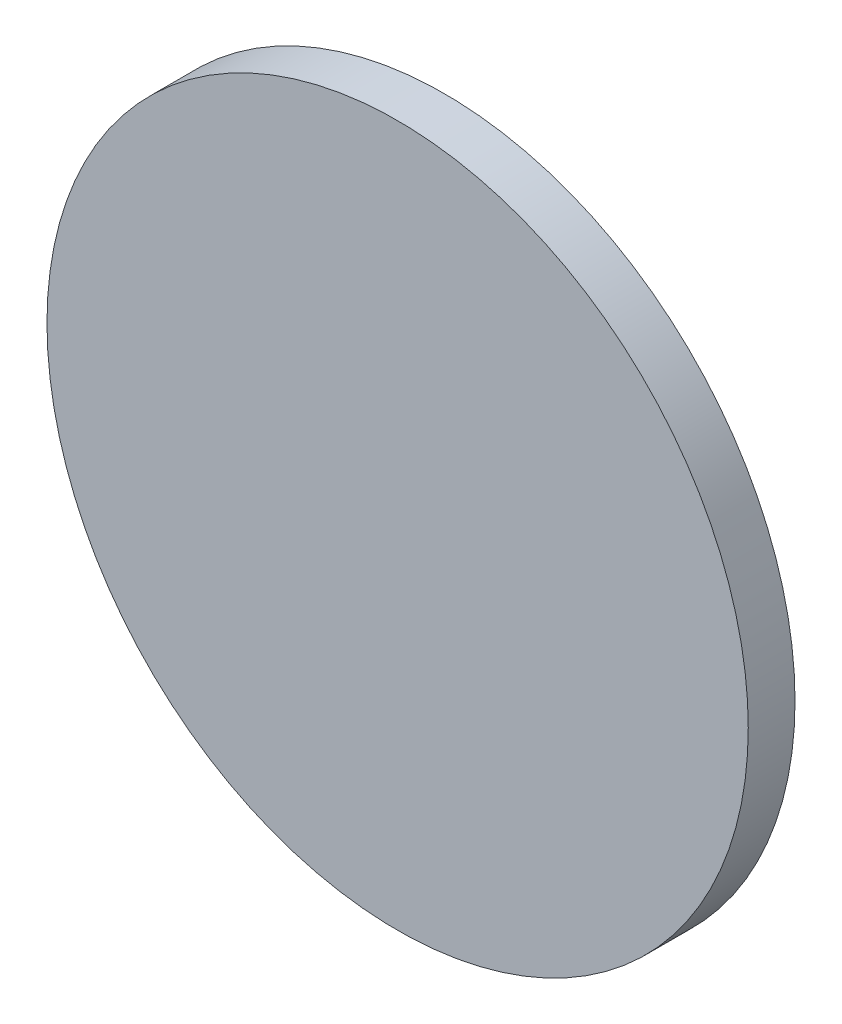
from build123d import *

# Parameters (mm, degrees)
SKETCH2_R           = 30
BOSS_EXTRUDE1_DEPTH = 4.001153813


with BuildPart() as part:
    # Sketch2 → Boss-Extrude1 (new body)
    with BuildSketch(Plane.XY):
        Circle(SKETCH2_R)
    extrude(amount=BOSS_EXTRUDE1_DEPTH)


solid = part.part
